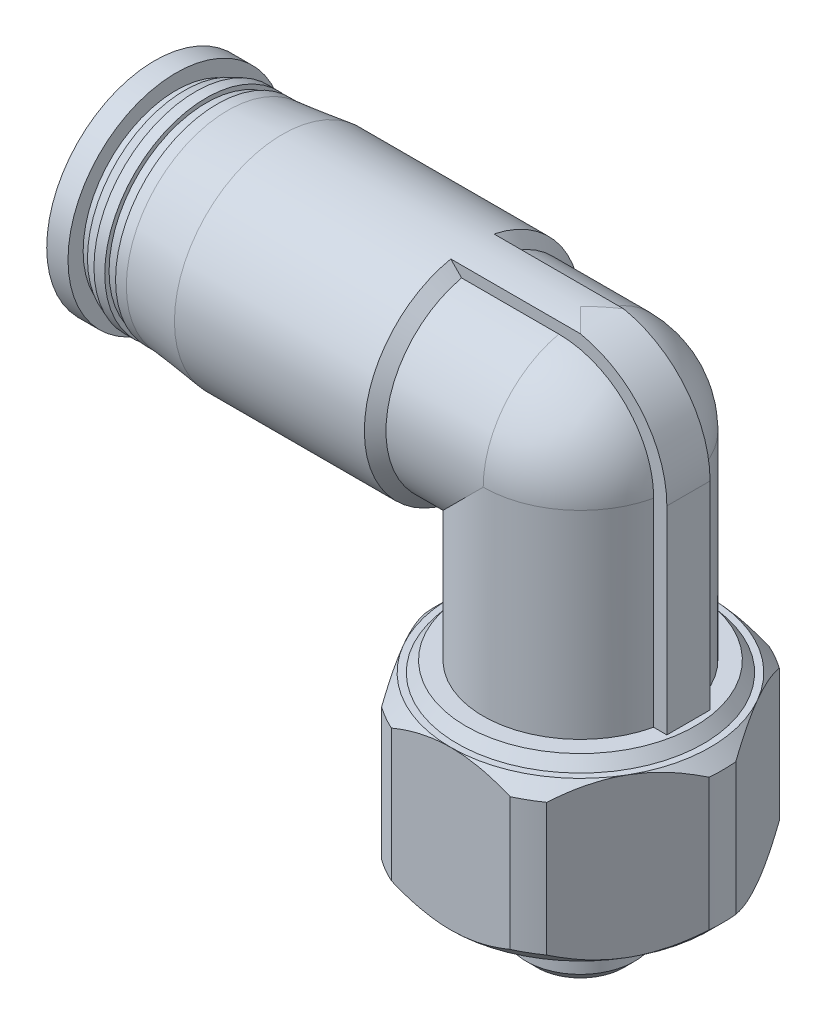
from build123d import *
from build123d.topology import SkipClean

# Parameters (mm, degrees)
SKETCH3_W                    = 24
SKETCH3_H                    = 24
CUT_EXTRUDE1_DEPTH           = 8.2
BOSS_EXTRUDE1_DEPTH          = 1
BOSS_EXTRUDE1_DEPTH_BACK     = 1
SKETCH6_R                    = 2
CUT_EXTRUDE2_DEPTH           = 19.7
SKETCH8_W                    = 10
SKETCH8_H                    = 2
CUT_REVOLVE2_ANGLE           = 30
CUT_REVOLVE2_OTHER_WAY_ANGLE = 30


with BuildPart() as part:
    # Sketch1 → Revolve1 (revolve)
    with BuildSketch(Plane.XY, mode=Mode.PRIVATE) as revolve1_sk:
        Polygon((0, 0), (-6, 0), (-6.6, 0.6), (-6.6, 6.721428571), (-6, 7.321428571), (-5.7, 7.321428571), (-5.3, 7.821428571), (-4.5, 7.821428571), (-4.5, 17), (0, 17), align=None)
    revolve(revolve1_sk.sketch.rotate(Axis((0, 17, 0), (0, -1, 0)), 90), axis=Axis((0, 17, 0), (0, -1, 0)))

    # Sketch2 → Revolve2 (revolve)
    with BuildSketch(Plane.XY, mode=Mode.PRIVATE) as revolve2_sk:
        Polygon((0, -3.5), (-2.0095, -3.5), (-2.5, -3.0095), (-2.5, -0.5), (-3.6, -0.5), (-3.6, 0), (0, 0), align=None)
    revolve(revolve2_sk.sketch.rotate(Axis((0, 0, 0), (0, -1, 0)), 90), axis=Axis((0, 0, 0), (0, -1, 0)))

    # Sketch3 → Cut-Extrude1 (cut)
    with BuildSketch(Plane(origin=(0, 0, 0), x_dir=(1, 0, 0), z_dir=(0, 1, 0))):
        Rectangle(SKETCH3_W, SKETCH3_H)
        Polygon((-6.92820323, 0), (-3.464101615, -6), (3.464101615, -6), (6.92820323, 0), (3.464101615, 6), (-3.464101615, 6), align=None, mode=Mode.SUBTRACT)
    extrude(amount=CUT_EXTRUDE1_DEPTH, mode=Mode.SUBTRACT)

    # Sketch4 → Revolve3 (revolve)
    with SkipClean():  # the faces are left unmerged after this step: merging them gives an invalid solid
        with BuildSketch(Plane.XY, mode=Mode.PRIVATE) as revolve3_sk:
            with BuildLine():
                Line((-19.7, 17), (-19.7, 22))
                Line((-19.7, 22), (-18.715, 22))
                Line((-18.715, 22), (-18.715, 21.3))
                Line((-18.715, 21.3), (-18.315, 21.3))
                Line((-18.315, 21.3), (-18.315, 21.5))
                Line((-18.315, 21.5), (-17.815, 21.7))
                Line((-17.815, 21.7), (-17.315, 21.7))
                Line((-17.315, 21.7), (-17.315, 21.5))
                Line((-17.315, 21.5), (-16.815, 21.5))
                Line((-16.815, 21.5), (-16.815, 21.7))
                Line((-16.815, 21.7), (-16.315, 21.7))
                Line((-16.315, 21.7), (-13.79, 22))
                Line((-13.79, 22), (-5, 22))
                Line((-5, 22), (-4.5, 21.5))
                Line((-4.5, 21.5), (0, 21.5))
                ThreePointArc((0, 21.5), (3.181980515, 20.181980515), (4.5, 17))
                Line((4.5, 17), (-19.7, 17))
            make_face()
        revolve(revolve3_sk.sketch.rotate(Axis((4.5, 17, 0), (-1, 0, 0)), 270), axis=Axis((4.5, 17, 0), (-1, 0, 0)))

    # Sketch5 → Boss-Extrude1 (add, two sides: drawn at the far end of the back side and taken through both)
    with BuildSketch(Plane.XY.offset(-BOSS_EXTRUDE1_DEPTH_BACK)):
        with BuildLine():
            Line((-5, 17), (0, 17))
            Line((0, 17), (0, 5.7))
            Line((0, 5.7), (5, 5.7))
            Line((5, 5.7), (5, 17))
            ThreePointArc((5, 17), (3.535533906, 20.535533906), (0, 22))
            Line((0, 22), (-5, 22))
            Line((-5, 22), (-5, 17))
        make_face()
    extrude(amount=BOSS_EXTRUDE1_DEPTH + BOSS_EXTRUDE1_DEPTH_BACK)

    # Sketch6 → Cut-Extrude2 (cut)
    with BuildSketch(Plane(origin=(0, 0, 0), x_dir=(0, 0, -1), z_dir=(1, 0, 0))):
        with Locations((0, 17)):
            Circle(SKETCH6_R)
    extrude(amount=-CUT_EXTRUDE2_DEPTH, mode=Mode.SUBTRACT)

    # Sketch7 → Cut-Revolve1 (revolve, cut)
    with BuildSketch(Plane.XY, mode=Mode.PRIVATE) as cut_revolve1_sk:
        with BuildLine():
            Line((0, -3.5), (-1.25, -3.5))
            Line((-1.25, -3.5), (-1.25, 1))
            Line((-1.25, 1), (-2, 1))
            Line((-2, 1), (-2, 17))
            ThreePointArc((-2, 17), (-1.414213562, 18.414213562), (0, 19))
            Line((0, 19), (0, -3.5))
        make_face()
    revolve(cut_revolve1_sk.sketch.rotate(Axis((0, 19, 0), (0, -1, 0)), 90), axis=Axis((0, 19, 0), (0, -1, 0)), mode=Mode.SUBTRACT)

    # Sketch8 → Cut-Revolve2 (revolve, cut)
    with BuildSketch(Plane.XY):
        with Locations((-2, 23)):
            Rectangle(SKETCH8_W, SKETCH8_H)
    revolve(axis=Axis((3, 17, 0), (-1, 0, 0)), revolution_arc=CUT_REVOLVE2_ANGLE, mode=Mode.SUBTRACT)

    # Sketch8 → Cut-Revolve2 other way (revolve, cut)
    with SkipClean():  # the faces are left unmerged after this step: merging them gives an invalid solid
        with BuildSketch(Plane.XY):
            with Locations((-2, 23)):
                Rectangle(SKETCH8_W, SKETCH8_H)
        revolve(axis=Axis((3, 17, 0), (1, 0, 0)), revolution_arc=CUT_REVOLVE2_OTHER_WAY_ANGLE, mode=Mode.SUBTRACT)


solid = part.part
